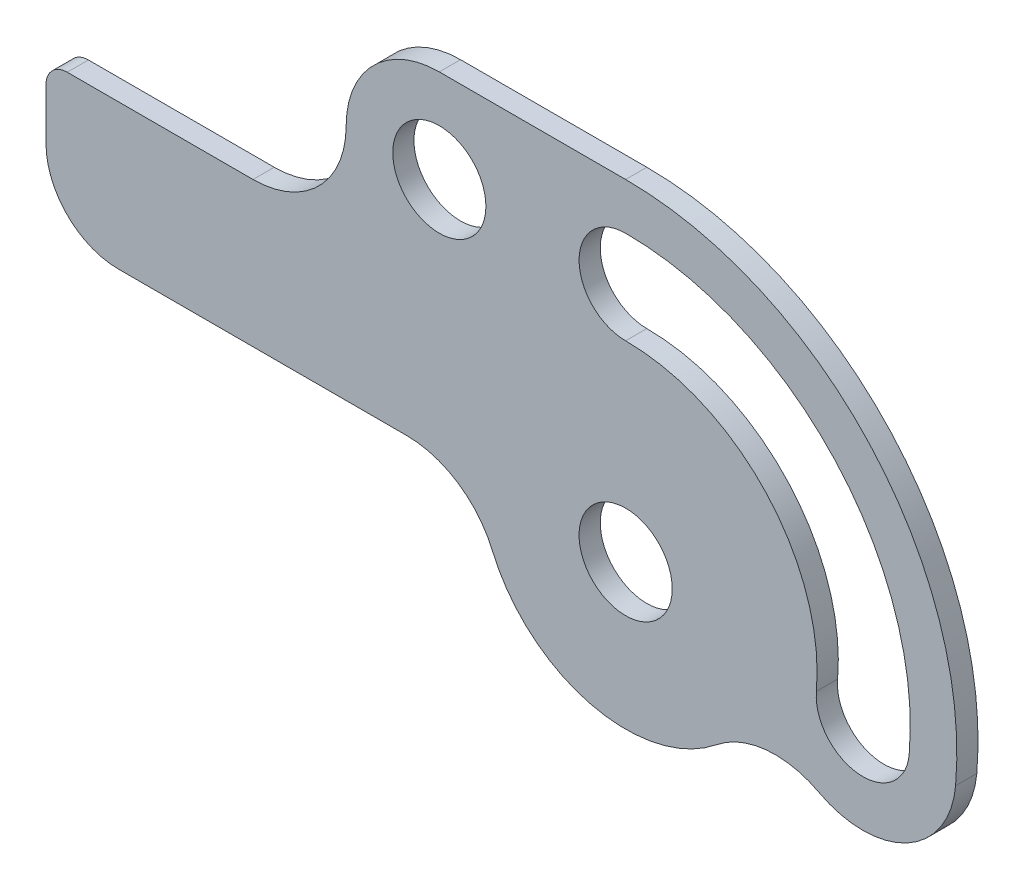
from build123d import *

# Parameters (mm, degrees)
SKETCH1_R           = 1.7859375
BOSS_EXTRUDE1_DEPTH = 0.8128


with BuildPart() as part:
    # Sketch1 → Boss-Extrude1 (new body)
    with BuildSketch(Plane.XY):
        with BuildLine():
            Line((2.778125, 0), (13.824739587, 0))
            ThreePointArc((13.824739587, 0), (15.795261881, -0.592725305), (17.111798004, -2.174184768))
            ThreePointArc((17.111798004, -2.174184768), (20.879142703, -5.390786788), (25.716280165, -4.322369358))
            ThreePointArc((25.716280165, -4.322369358), (27.621647146, -3.545286331), (29.639532121, -3.948301955))
            ThreePointArc((29.639532121, -3.948301955), (33.02176359, -3.935123977), (34.876672666, -1.106877933))
            ThreePointArc((34.876672666, -1.106877933), (31.588422177, 8.579995637), (22.225, 12.7))
            Line((22.225, 12.7), (15.08125, 12.7))
            ThreePointArc((15.08125, 12.7), (12.555552966, 11.653822034), (11.509375, 9.128125))
            ThreePointArc((11.509375, 9.128125), (10.463197034, 6.602427966), (7.9375, 5.55625))
            Line((7.9375, 5.55625), (0.813693974, 5.55625))
            ThreePointArc((0.813693974, 5.55625), (0.238325447, 5.317924553), (0, 4.742556026))
            Line((0, 4.742556026), (0, 2.778125))
            ThreePointArc((0, 2.778125), (0.813693974, 0.813693974), (2.778125, 0))
        make_face()
        with BuildLine():
            ThreePointArc((33.097531197, -0.951223224), (31.162735019, -2.574709983), (29.53924826, -0.639913805))
            ThreePointArc((29.53924826, -0.639913805), (27.638228446, 4.960309977), (22.225, 7.3421875))
            ThreePointArc((22.225, 7.3421875), (20.4390625, 9.128125), (22.225, 10.9140625))
            ThreePointArc((22.225, 10.9140625), (30.271690934, 7.37343375), (33.097531197, -0.951223224))
        make_face(mode=Mode.SUBTRACT)
        with Locations((22.225, 0)):
            Circle(SKETCH1_R, mode=Mode.SUBTRACT)
        with Locations((15.08125, 9.128125)):
            Circle(SKETCH1_R, mode=Mode.SUBTRACT)
    extrude(amount=BOSS_EXTRUDE1_DEPTH)


solid = part.part
